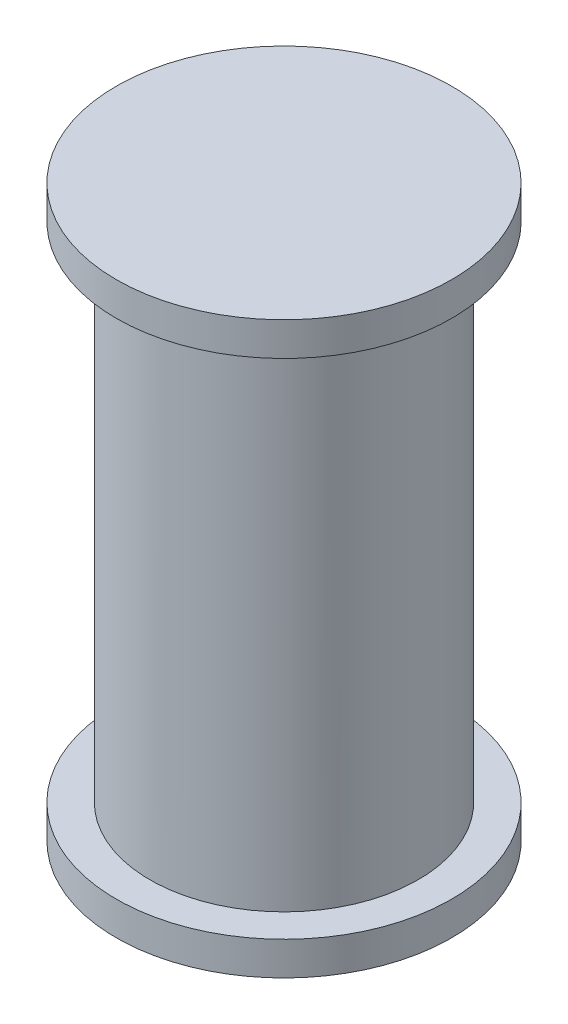
from build123d import *

# Parameters (mm, degrees)
CROQUIS1_R              = 4
SALIENTE_EXTRUIR1_DEPTH = 15
CROQUIS2_R              = 5
SALIENTE_EXTRUIR2_DEPTH = 1
SALIENTE_EXTRUIR3_START = 1
CROQUIS3_R              = 5
SALIENTE_EXTRUIR3_DEPTH = 1


with BuildPart() as part:
    # Croquis1 → Saliente-Extruir1 (new body)
    with BuildSketch(Plane(origin=(0, 0, 0), x_dir=(1, 0, 0), z_dir=(0, 1, 0))):
        with Locations(Location((0, 0, 0), (0, 0, 270))):
            Circle(CROQUIS1_R)
    extrude(amount=SALIENTE_EXTRUIR1_DEPTH)

    # Croquis2 → Saliente-Extruir2 (add)
    with BuildSketch(Plane(origin=(0, 15, 0), x_dir=(1, 0, 0), z_dir=(0, 1, 0))):
        with Locations(Location((0, 0, 0), (0, 0, 270))):
            Circle(CROQUIS2_R)
    extrude(amount=SALIENTE_EXTRUIR2_DEPTH)

    # Croquis3 → Saliente-Extruir3 (add)
    with BuildSketch(Plane.XZ.offset(SALIENTE_EXTRUIR3_START)):
        with Locations(Location((0, 0, 0), (0, 0, 90))):
            Circle(CROQUIS3_R)
    extrude(amount=-SALIENTE_EXTRUIR3_DEPTH)


solid = part.part
